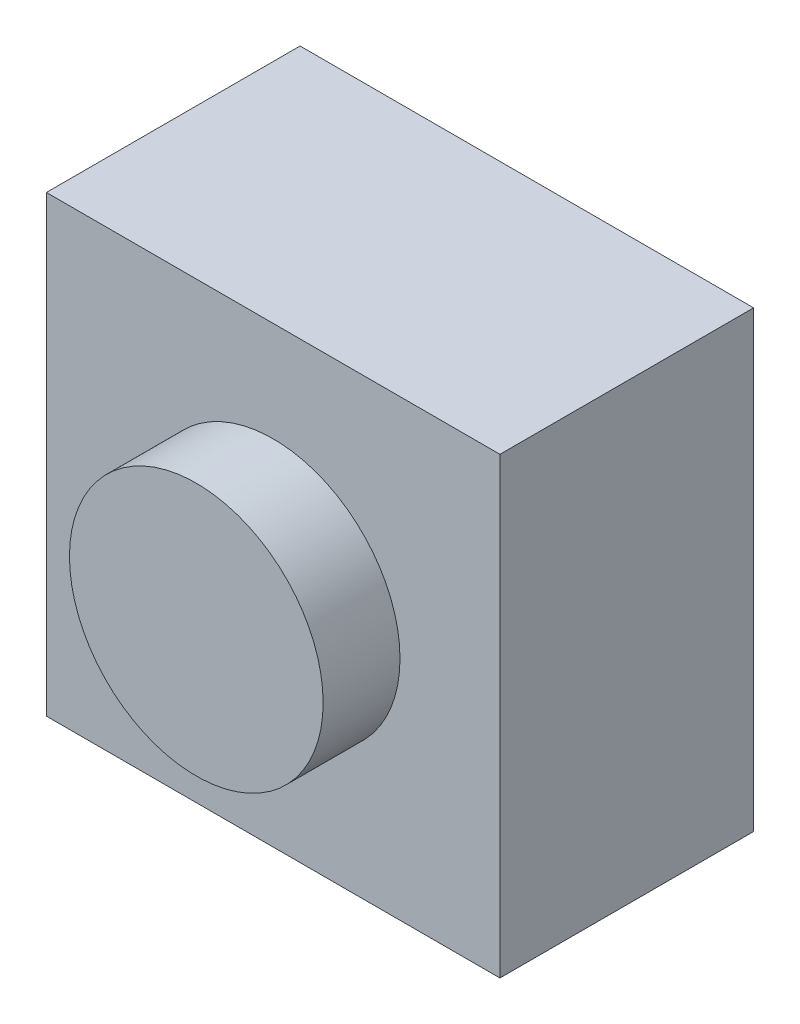
from build123d import *

# Parameters (mm, degrees)
ESBO_O1_W                = 5.9
ESBO_O1_H                = 5.9
RESSALTO_EXTRUS_O1_DEPTH = 3.3
ESBO_O2_R                = 1.65
RESSALTO_EXTRUS_O2_DEPTH = 1


with BuildPart() as part:
    # Esboço1 → Ressalto-extrusão1 (new body)
    with BuildSketch(Plane.XY):
        Rectangle(ESBO_O1_W, ESBO_O1_H)
    extrude(amount=RESSALTO_EXTRUS_O1_DEPTH)

    # Esboço2 → Ressalto-extrusão2 (add)
    with BuildSketch(Plane.XY.offset(3.3)):
        Circle(ESBO_O2_R)
    extrude(amount=RESSALTO_EXTRUS_O2_DEPTH)


solid = part.part
